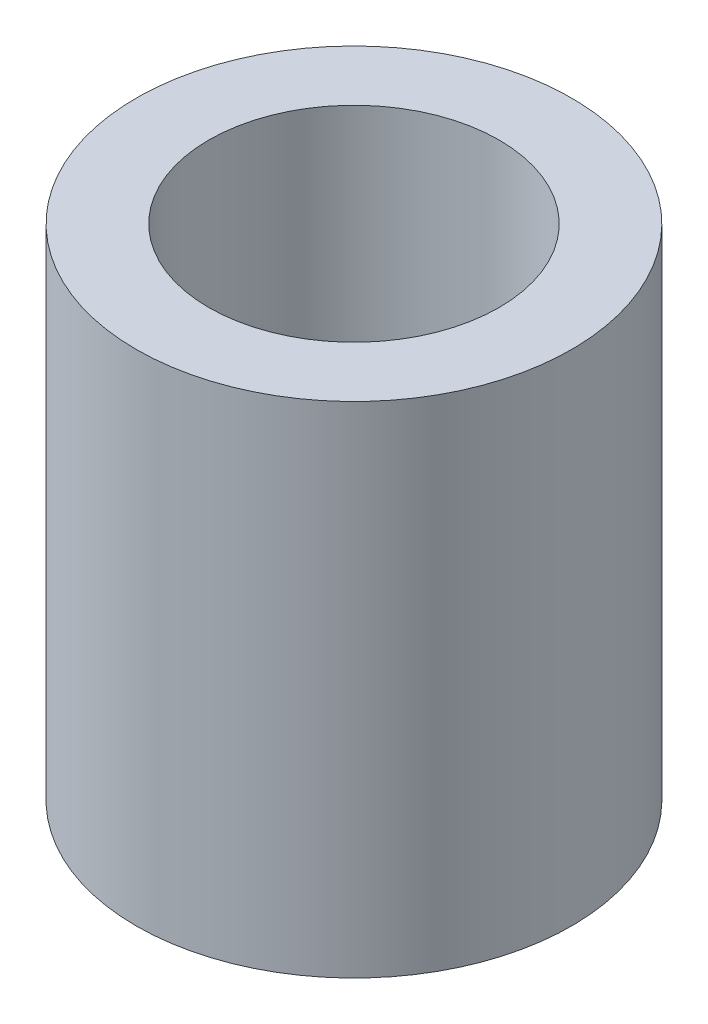
from build123d import *

# Parameters (mm, degrees)
SKETCH1_R           = 9.525
SKETCH1_R_2         = 6.35
BOSS_EXTRUDE1_DEPTH = 21.844


with BuildPart() as part:
    # Sketch1 → Boss-Extrude1 (new body)
    with BuildSketch(Plane(origin=(0, 0, 0), x_dir=(1, 0, 0), z_dir=(0, 1, 0))):
        with Locations(Location((-45.883254306, 24.538829043, 0), (0, 0, 270))):
            Circle(SKETCH1_R)
        with Locations(Location((-45.883254306, 24.538829043, 0), (0, 0, 270))):
            Circle(SKETCH1_R_2, mode=Mode.SUBTRACT)
    extrude(amount=BOSS_EXTRUDE1_DEPTH)


solid = part.part
